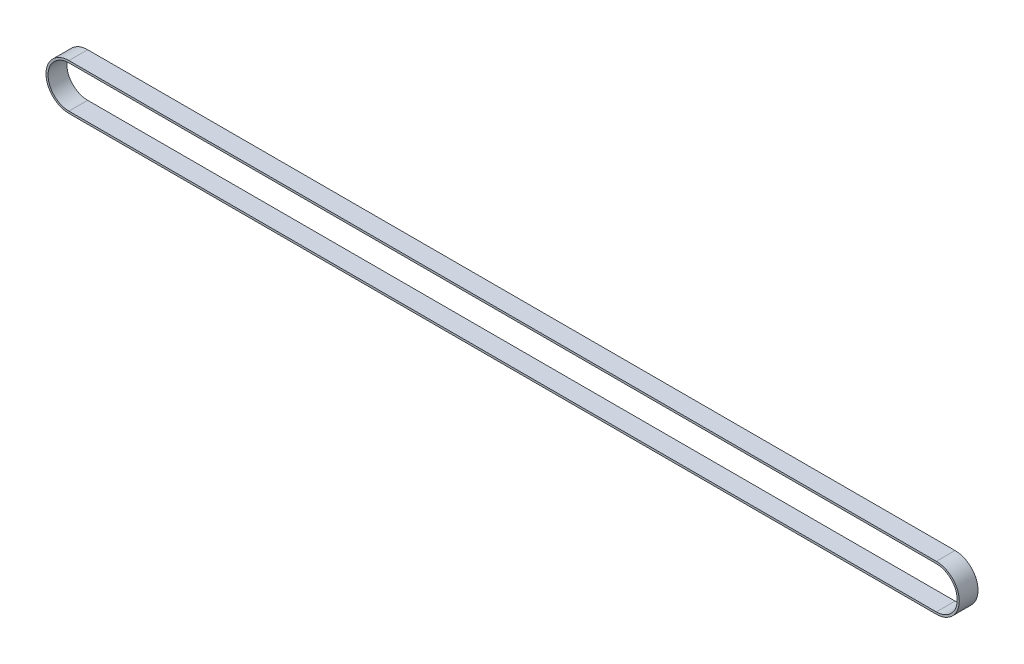
from build123d import *

# Parameters (mm, degrees)
EXTRUDE_START   = -1
EXTRUDE_1_DEPTH = 20


with BuildPart() as part:
    # 草图2 → 拉伸-薄壁1 (new body)
    with BuildSketch(Plane.XY.offset(EXTRUDE_START)):
        with BuildLine():
            Line((-21.748860904, -24.1900881), (-947.748860904, -24.1900881))
            ThreePointArc((-947.748860904, -24.1900881), (-972.223860904, 0.2849119), (-947.748860904, 24.7599119))
            Line((-947.748860904, 24.7599119), (-21.748860904, 24.7599119))
            ThreePointArc((-21.748860904, 24.7599119), (2.726139096, 0.284911899), (-21.748860904, -24.1900881))
        make_face()
        with BuildLine():
            Line((-21.748860904, -21.9900881), (-947.748860904, -21.9900881))
            ThreePointArc((-947.748860904, -21.9900881), (-970.023860904, 0.2849119), (-947.748860904, 22.5599119))
            Line((-947.748860904, 22.5599119), (-21.748860904, 22.5599119))
            ThreePointArc((-21.748860904, 22.5599119), (0.526139096, 0.284911899), (-21.748860904, -21.9900881))
        make_face(mode=Mode.SUBTRACT)
    extrude(amount=-EXTRUDE_1_DEPTH)


solid = part.part
